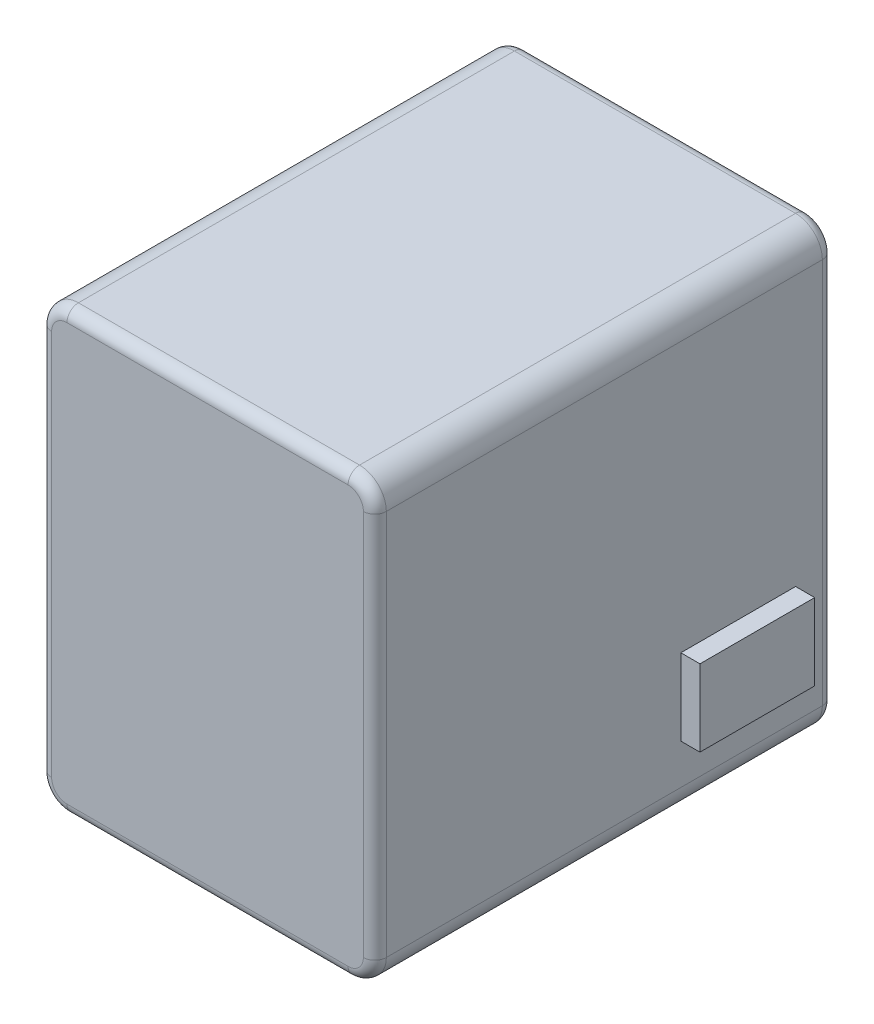
from build123d import *

# Parameters (mm, degrees)
BLOCK_START            = 303
BLOCK_1_DEPTH          = 240
BLOCK_EDGE_FILLET_1_R  = 6
EXTRUDE_SKETCH_1_W     = 60
EXTRUDE_SKETCH_1_H     = 40
EXTRUDE_1_DEPTH        = 10
EXTRUDE_ROTATE_1_ANGLE = 90


with BuildPart() as part:
    # Block sketch 1 → Block 1 (new body)
    with BuildSketch(Plane.XY.offset(BLOCK_START)):
        with BuildLine():
            Line((684, -115), (831, -115))
            ThreePointArc((831, -115), (840.899494937, -110.899494937), (845, -101))
            Line((845, -101), (845, 101))
            ThreePointArc((845, 101), (840.899494937, 110.899494937), (831, 115))
            Line((831, 115), (684, 115))
            ThreePointArc((684, 115), (674.100505063, 110.899494937), (670, 101))
            Line((670, 101), (670, -101))
            ThreePointArc((670, -101), (674.100505063, -110.899494937), (684, -115))
        make_face()
    extrude(amount=BLOCK_1_DEPTH)

    # Block edge fillet 1
    block_edge_fillet_1_edges = [part.edges().sort_by_distance(p)[0] for p in [
        (674.100505063, -110.899494937, 543),
        (674.100505063, 110.899494937, 543),
        (840.899494937, 110.899494937, 543),
        (840.899494937, -110.899494937, 543),
        (840.899494937, 110.899494937, 303),
        (840.899494937, -110.899494937, 303),
        (757.5, -115, 303),
        (674.100505063, -110.899494937, 303),
        (670, 0, 303),
        (674.100505063, 110.899494937, 303),
        (845, 0, 543),
        (670, 0, 543),
        (757.5, 115, 543),
        (757.5, -115, 543),
        (845, 0, 303),
        (757.5, 115, 303),
    ]]
    fillet(block_edge_fillet_1_edges, radius=BLOCK_EDGE_FILLET_1_R)


with BuildPart() as body_2:
    # Extrude sketch 1 → Extrude 1 (new body)
    with BuildSketch(Plane.XY):
        Rectangle(EXTRUDE_SKETCH_1_W, EXTRUDE_SKETCH_1_H)
    extrude(amount=EXTRUDE_1_DEPTH)


with BuildPart() as body_2_1:
    # Extrude rotate 1: moved
    add(body_2.part.rotate(Axis((0, 0, 0), (0, 1, 0)), EXTRUDE_ROTATE_1_ANGLE))


with BuildPart() as body_2_2:
    # Extrude place 1: moved
    add(body_2_1.part.moved(Location((845, -60, 353))))

    # Combine (weld / assembly of features): union part
    add(part.part)


solid = body_2_2.part
